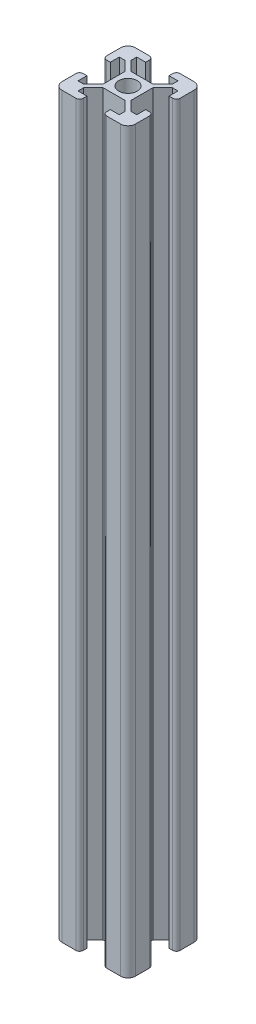
from build123d import *

# Parameters (mm, degrees)
SKETCH_1_W      = 2.42
SKETCH_1_H      = 2
SKETCH_1_W_2    = 2
SKETCH_1_H_2    = 2.42
EXTRUDE_1_DEPTH = 200
FILLET_1_R      = 2
FILLET_2_R      = 1


with BuildPart() as part:
    # 草图1 → 凸台-拉伸1 (new body)
    with BuildSketch(Plane(origin=(0, 0, 0), x_dir=(1, 0, 0), z_dir=(0, 1, 0))):
        with Locations((-4.38, 8.95)):
            Rectangle(SKETCH_1_W, SKETCH_1_H)
        Polygon((-7.101471863, 7.95), (-5.59, 7.95), (-5.59, 9.95), (-7.95, 9.95), (-7.95, 8.798528137), align=None)
        Polygon((-9.101471863, 9.95), (-7.95, 8.798528137), (-7.95, 9.95), align=None)
        Polygon((-9.95, 9.101471863), (-8.798528137, 7.95), (-7.95, 7.95), (-7.95, 8.798528137), (-9.101471863, 9.95), (-9.95, 9.95), align=None)
        Polygon((-9.95, 7.95), (-8.798528137, 7.95), (-9.95, 9.101471863), align=None)
        Polygon((-9.95, 5.59), (-7.95, 5.59), (-7.95, 7.101471863), (-8.798528137, 7.95), (-9.95, 7.95), align=None)
        Polygon((-7.95, 7.95), (-7.101471863, 7.95), (-7.95, 8.798528137), align=None)
        Polygon((-8.798528137, 7.95), (-7.95, 7.101471863), (-7.95, 7.95), align=None)
        with Locations((-8.95, 4.38)):
            Rectangle(SKETCH_1_W_2, SKETCH_1_H_2)
        Polygon((-7.101471863, 7.95), (-5.59, 6.438528137), (-5.59, 7.95), align=None)
        Polygon((-7.95, 7.101471863), (-6.438528137, 5.59), (-5.59, 5.59), (-5.59, 6.438528137), (-7.101471863, 7.95), (-7.95, 7.95), align=None)
        Polygon((-7.95, 5.59), (-6.438528137, 5.59), (-7.95, 7.101471863), align=None)
        Polygon((-6.438528137, 5.59), (-3.8, 2.951471863), (-3.8, 3.8), (-2.951471863, 3.8), (-5.59, 6.438528137), (-5.59, 5.59), align=None)
        with Locations((4.38, 8.95)):
            Rectangle(SKETCH_1_W, SKETCH_1_H)
        Polygon((7.101471863, 7.95), (7.95, 8.798528137), (7.95, 9.95), (5.59, 9.95), (5.59, 7.95), align=None)
        Polygon((7.95, 8.798528137), (9.101471863, 9.95), (7.95, 9.95), align=None)
        Polygon((8.798528137, 7.95), (9.95, 9.101471863), (9.95, 9.95), (9.101471863, 9.95), (7.95, 8.798528137), (7.95, 7.95), align=None)
        Polygon((8.798528137, 7.95), (9.95, 7.95), (9.95, 9.101471863), align=None)
        Polygon((7.95, 5.59), (9.95, 5.59), (9.95, 7.95), (8.798528137, 7.95), (7.95, 7.101471863), align=None)
        Polygon((7.101471863, 7.95), (7.95, 7.95), (7.95, 8.798528137), align=None)
        Polygon((7.95, 7.101471863), (8.798528137, 7.95), (7.95, 7.95), align=None)
        with Locations((8.95, 4.38)):
            Rectangle(SKETCH_1_W_2, SKETCH_1_H_2)
        Polygon((5.59, 5.59), (6.438528137, 5.59), (7.95, 7.101471863), (7.95, 7.95), (7.101471863, 7.95), (5.59, 6.438528137), align=None)
        Polygon((6.438528137, 5.59), (7.95, 5.59), (7.95, 7.101471863), align=None)
        Polygon((5.59, 7.95), (5.59, 6.438528137), (7.101471863, 7.95), align=None)
        Polygon((3.8, 3.8), (3.8, 2.951471863), (6.438528137, 5.59), (5.59, 5.59), (5.59, 6.438528137), (2.951471863, 3.8), align=None)
        with Locations((8.95, -4.38)):
            Rectangle(SKETCH_1_W_2, SKETCH_1_H_2)
        Polygon((8.798528137, -7.95), (9.95, -7.95), (9.95, -5.59), (7.95, -5.59), (7.95, -7.101471863), align=None)
        Polygon((8.798528137, -7.95), (9.95, -9.101471863), (9.95, -7.95), align=None)
        Polygon((9.101471863, -9.95), (9.95, -9.95), (9.95, -9.101471863), (8.798528137, -7.95), (7.95, -7.95), (7.95, -8.798528137), align=None)
        Polygon((7.95, -9.95), (9.101471863, -9.95), (7.95, -8.798528137), align=None)
        Polygon((7.95, -7.95), (8.798528137, -7.95), (7.95, -7.101471863), align=None)
        Polygon((7.101471863, -7.95), (7.95, -8.798528137), (7.95, -7.95), align=None)
        Polygon((5.59, -9.95), (7.95, -9.95), (7.95, -8.798528137), (7.101471863, -7.95), (5.59, -7.95), align=None)
        with Locations((4.38, -8.95)):
            Rectangle(SKETCH_1_W, SKETCH_1_H)
        Polygon((5.59, -7.95), (7.101471863, -7.95), (5.59, -6.438528137), align=None)
        Polygon((5.59, -6.438528137), (7.101471863, -7.95), (7.95, -7.95), (7.95, -7.101471863), (6.438528137, -5.59), (5.59, -5.59), align=None)
        Polygon((6.438528137, -5.59), (7.95, -7.101471863), (7.95, -5.59), align=None)
        with Locations((-8.95, -4.38)):
            Rectangle(SKETCH_1_W_2, SKETCH_1_H_2)
        Polygon((-8.798528137, -7.95), (-7.95, -7.101471863), (-7.95, -5.59), (-9.95, -5.59), (-9.95, -7.95), align=None)
        Polygon((-7.95, -7.101471863), (-6.438528137, -5.59), (-7.95, -5.59), align=None)
        Polygon((-7.101471863, -7.95), (-5.59, -6.438528137), (-5.59, -5.59), (-6.438528137, -5.59), (-7.95, -7.101471863), (-7.95, -7.95), align=None)
        Polygon((-7.101471863, -7.95), (-5.59, -7.95), (-5.59, -6.438528137), align=None)
        Polygon((-7.95, -9.95), (-5.59, -9.95), (-5.59, -7.95), (-7.101471863, -7.95), (-7.95, -8.798528137), align=None)
        with Locations((-4.38, -8.95)):
            Rectangle(SKETCH_1_W, SKETCH_1_H)
        Polygon((-7.95, -7.95), (-7.95, -8.798528137), (-7.101471863, -7.95), align=None)
        Polygon((-8.798528137, -7.95), (-7.95, -7.95), (-7.95, -7.101471863), align=None)
        Polygon((-9.95, -9.95), (-9.101471863, -9.95), (-7.95, -8.798528137), (-7.95, -7.95), (-8.798528137, -7.95), (-9.95, -9.101471863), align=None)
        Polygon((-9.95, -7.95), (-9.95, -9.101471863), (-8.798528137, -7.95), align=None)
        Polygon((-9.101471863, -9.95), (-7.95, -9.95), (-7.95, -8.798528137), align=None)
        Polygon((-5.59, -6.438528137), (-2.951471863, -3.8), (-3.8, -3.8), (-3.8, -2.951471863), (-6.438528137, -5.59), (-5.59, -5.59), align=None)
        Polygon((2.951471863, -3.8), (5.59, -6.438528137), (5.59, -5.59), (6.438528137, -5.59), (3.8, -2.951471863), (3.8, -3.8), align=None)
        with BuildLine():
            Line((2.140364299, -1.291836161), (3.8, -2.951471863))
            Line((3.8, -2.951471863), (3.8, 2.951471863))
            Line((3.8, 2.951471863), (2.140364299, 1.291836161))
            ThreePointArc((2.140364299, 1.291836161), (2.408413456, 0.670480892), (2.5, 0))
            ThreePointArc((2.5, 0), (2.408413456, -0.670480892), (2.140364299, -1.291836161))
        make_face()
        with BuildLine():
            Line((1.291836161, 2.140364299), (2.951471863, 3.8))
            Line((2.951471863, 3.8), (-2.951471863, 3.8))
            Line((-2.951471863, 3.8), (-1.291836161, 2.140364299))
            ThreePointArc((-1.291836161, 2.140364299), (0, 2.5), (1.291836161, 2.140364299))
        make_face()
        with BuildLine():
            Line((-3.8, 2.951471863), (-3.8, -2.951471863))
            Line((-3.8, -2.951471863), (-2.140364299, -1.291836161))
            ThreePointArc((-2.140364299, -1.291836161), (-2.5, 0), (-2.140364299, 1.291836161))
            Line((-2.140364299, 1.291836161), (-3.8, 2.951471863))
        make_face()
        with BuildLine():
            Line((-2.951471863, -3.8), (2.951471863, -3.8))
            Line((2.951471863, -3.8), (1.291836161, -2.140364299))
            ThreePointArc((1.291836161, -2.140364299), (0, -2.5), (-1.291836161, -2.140364299))
            Line((-1.291836161, -2.140364299), (-2.951471863, -3.8))
        make_face()
        with BuildLine():
            Line((-3.8, -3.8), (-2.951471863, -3.8))
            Line((-2.951471863, -3.8), (-1.291836161, -2.140364299))
            ThreePointArc((-1.291836161, -2.140364299), (-1.767766953, -1.767766953), (-2.140364299, -1.291836161))
            Line((-2.140364299, -1.291836161), (-3.8, -2.951471863))
            Line((-3.8, -2.951471863), (-3.8, -3.8))
        make_face()
        with BuildLine():
            Line((1.291836161, -2.140364299), (2.951471863, -3.8))
            Line((2.951471863, -3.8), (3.8, -3.8))
            Line((3.8, -3.8), (3.8, -2.951471863))
            Line((3.8, -2.951471863), (2.140364299, -1.291836161))
            ThreePointArc((2.140364299, -1.291836161), (1.767766953, -1.767766953), (1.291836161, -2.140364299))
        make_face()
        with BuildLine():
            Line((2.140364299, 1.291836161), (3.8, 2.951471863))
            Line((3.8, 2.951471863), (3.8, 3.8))
            Line((3.8, 3.8), (2.951471863, 3.8))
            Line((2.951471863, 3.8), (1.291836161, 2.140364299))
            ThreePointArc((1.291836161, 2.140364299), (1.767766953, 1.767766953), (2.140364299, 1.291836161))
        make_face()
        with BuildLine():
            Line((-3.8, 3.8), (-3.8, 2.951471863))
            Line((-3.8, 2.951471863), (-2.140364299, 1.291836161))
            ThreePointArc((-2.140364299, 1.291836161), (-1.767766953, 1.767766953), (-1.291836161, 2.140364299))
            Line((-1.291836161, 2.140364299), (-2.951471863, 3.8))
            Line((-2.951471863, 3.8), (-3.8, 3.8))
        make_face()
    extrude(amount=EXTRUDE_1_DEPTH)

    # 圆角1
    fillet_1_edges = [part.edges().sort_by_distance(p)[0] for p in [
        (-9.95, 100, 9.95),
        (-9.95, 100, -9.95),
        (9.95, 100, -9.95),
        (9.95, 100, 9.95),
    ]]
    fillet(fillet_1_edges, radius=FILLET_1_R)

    # 圆角2
    fillet_2_edges = [part.edges().sort_by_distance(p)[0] for p in [
        (3.17, 100, 9.95),
        (-3.17, 100, 9.95),
        (-9.95, 100, 3.17),
        (-9.95, 100, -3.17),
        (-3.17, 100, -9.95),
        (3.17, 100, -9.95),
        (9.95, 100, -3.17),
        (9.95, 100, 3.17),
    ]]
    fillet(fillet_2_edges, radius=FILLET_2_R)


solid = part.part
